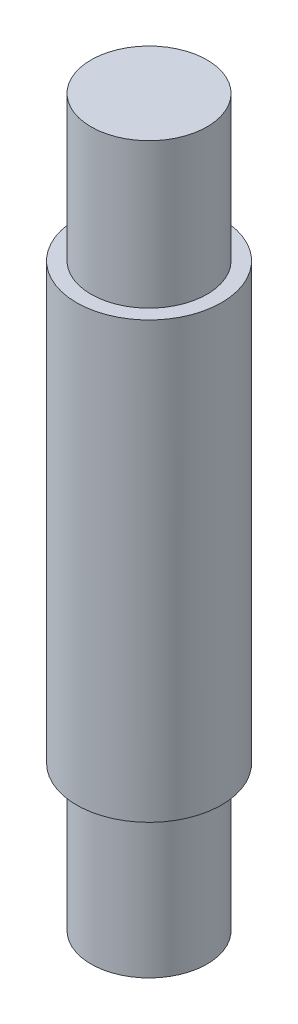
from build123d import *

# Parameters (mm, degrees)
SKETCH1_R           = 5
BOSS_EXTRUDE1_DEPTH = 50
CUT_EXTRUDE1_START  = -10
SKETCH2_R           = 5
SKETCH2_R_2         = 4
CUT_EXTRUDE1_DEPTH  = 10
SKETCH3_R           = 5
SKETCH3_R_2         = 4
CUT_EXTRUDE2_DEPTH  = 10


with BuildPart() as part:
    # Sketch1 → Boss-Extrude1 (new body)
    with BuildSketch(Plane(origin=(0, 0, 0), x_dir=(1, 0, 0), z_dir=(0, 1, 0))):
        with Locations(Location((0, 0, 0), (0, 0, 270))):
            Circle(SKETCH1_R)
    extrude(amount=BOSS_EXTRUDE1_DEPTH)

    # Sketch2 → Cut-Extrude1 (cut)
    with BuildSketch(Plane(origin=(0, 50, 0), x_dir=(1, 0, 0), z_dir=(0, 1, 0)).offset(CUT_EXTRUDE1_START)):
        with Locations(Location((0, 0, 0), (0, 0, 270))):
            Circle(SKETCH2_R)
        with Locations(Location((0, 0, 0), (0, 0, 270))):
            Circle(SKETCH2_R_2, mode=Mode.SUBTRACT)
    extrude(amount=CUT_EXTRUDE1_DEPTH, mode=Mode.SUBTRACT)

    # Sketch3 → Cut-Extrude2 (cut)
    with BuildSketch(Plane.XZ):
        with Locations(Location((0, 0, 0), (0, 0, 270))):
            Circle(SKETCH3_R)
        with Locations(Location((0, 0, 0), (0, 0, 90))):
            Circle(SKETCH3_R_2, mode=Mode.SUBTRACT)
    extrude(amount=-CUT_EXTRUDE2_DEPTH, mode=Mode.SUBTRACT)


solid = part.part
